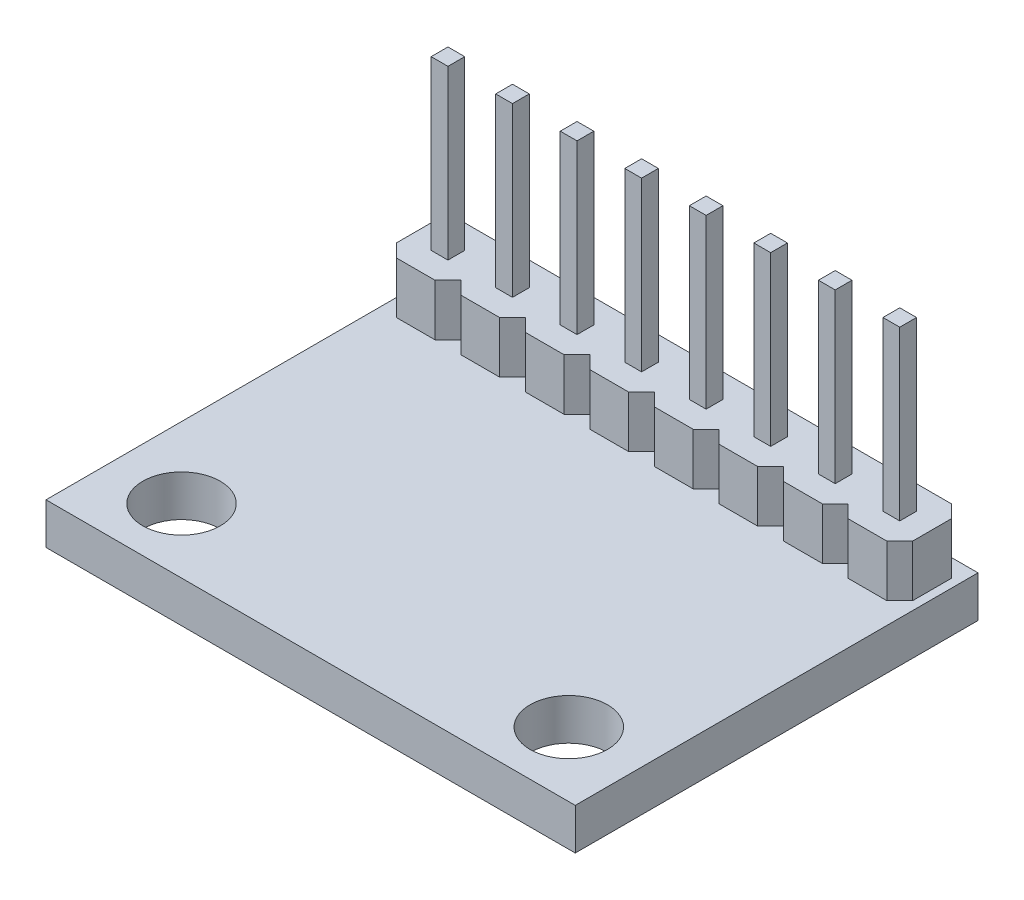
from build123d import *

# Parameters (mm, degrees)
SKETCH1_W           = 20.5
SKETCH1_H           = 15.6
SKETCH1_R           = 1.5
BOSS_EXTRUDE1_DEPTH = 1.6
BOSS_EXTRUDE2_DEPTH = 2
BOSS_EXTRUDE3_START = -4
SKETCH3_W           = 0.65
SKETCH3_H           = 0.65
BOSS_EXTRUDE3_DEPTH = 10.5
LPATTERN1_COUNT     = 8
LPATTERN1_PITCH     = 2.5


with BuildPart() as part:
    # Sketch1 → Boss-Extrude1 (new body)
    with BuildSketch(Plane(origin=(0, 0, 0), x_dir=(1, 0, 0), z_dir=(0, 1, 0))):
        with Locations((0, 7.8)):
            Rectangle(SKETCH1_W, SKETCH1_H)
        with Locations(Location((7.5, 2.5, 0), (0, 0, 270))):
            Circle(SKETCH1_R, mode=Mode.SUBTRACT)
        with Locations(Location((-7.5, 2.5, 0), (0, 0, 90))):
            Circle(SKETCH1_R, mode=Mode.SUBTRACT)
    extrude(amount=BOSS_EXTRUDE1_DEPTH)

    # Sketch2 → Boss-Extrude2 (add)
    with BuildSketch(Plane(origin=(0, 1.6, 0), x_dir=(1, 0, 0), z_dir=(0, 1, 0))):
        Polygon((7.918720213, 15.4), (7.418720213, 14.9), (6.918720213, 15.4), (5.418720213, 15.4), (4.918720213, 14.9), (4.418720213, 15.4), (2.918720213, 15.4), (2.418720213, 14.9), (1.918720213, 15.4), (0.418720213, 15.4), (-0.081279787, 14.9), (-0.581279787, 15.4), (-2.081279787, 15.4), (-2.581279787, 14.9), (-3.081279787, 15.4), (-4.581279787, 15.4), (-5.081279787, 14.9), (-5.581279787, 15.4), (-7.081279787, 15.4), (-7.581279787, 14.9), (-8.081279787, 15.4), (-9.581279787, 15.4), (-10.081279787, 14.9), (-10.081279787, 13.4), (-9.581279787, 12.9), (-8.081279787, 12.9), (-7.581279787, 13.4), (-7.081279787, 12.9), (-5.581279787, 12.9), (-5.081279787, 13.4), (-4.581279787, 12.9), (-3.081279787, 12.9), (-2.581279787, 13.4), (-2.081279787, 12.9), (-0.581279787, 12.9), (-0.081279787, 13.4), (0.418720213, 12.9), (1.918720213, 12.9), (2.418720213, 13.4), (2.918720213, 12.9), (4.418720213, 12.9), (4.918720213, 13.4), (5.418720213, 12.9), (6.918720213, 12.9), (7.418720213, 13.4), (7.918720213, 12.9), (9.418720213, 12.9), (9.918720213, 13.4), (9.918720213, 14.9), (9.418720213, 15.4), align=None)
    extrude(amount=BOSS_EXTRUDE2_DEPTH)

    # Sketch3 → Boss-Extrude3 (add)
    with BuildSketch(Plane(origin=(0, 3.6, 0), x_dir=(1, 0, 0), z_dir=(0, 1, 0)).offset(BOSS_EXTRUDE3_START)):
        with Locations((8.668720213, 14.15)):
            Rectangle(SKETCH3_W, SKETCH3_H)
    boss_extrude3 = extrude(amount=BOSS_EXTRUDE3_DEPTH)

    # LPattern1: Boss-Extrude3 ×8
    with Locations(*[(-i * LPATTERN1_PITCH, 0, 0) for i in range(1, LPATTERN1_COUNT)]):
        add(boss_extrude3)


solid = part.part
